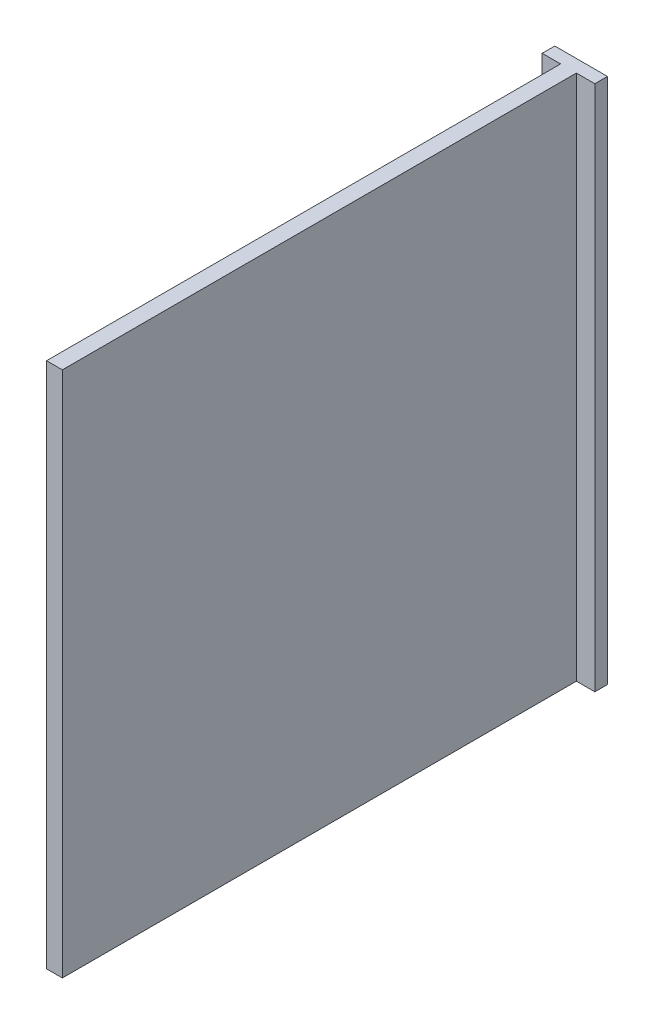
from build123d import *

# Parameters (mm, degrees)
BOSS_EXTRUDE1_DEPTH = 25


with BuildPart() as part:
    # Sketch1 → Boss-Extrude1 (new body)
    with BuildSketch(Plane(origin=(0, 0, 0), x_dir=(1, 0, 0), z_dir=(0, 1, 0))):
        Polygon((-1.25, 0), (1.25, 0), (1.25, -0.6), (0.375, -0.6), (0.375, -25), (-0.375, -25), (-0.375, -0.6), (-1.25, -0.6), align=None)
    extrude(amount=BOSS_EXTRUDE1_DEPTH)


solid = part.part
